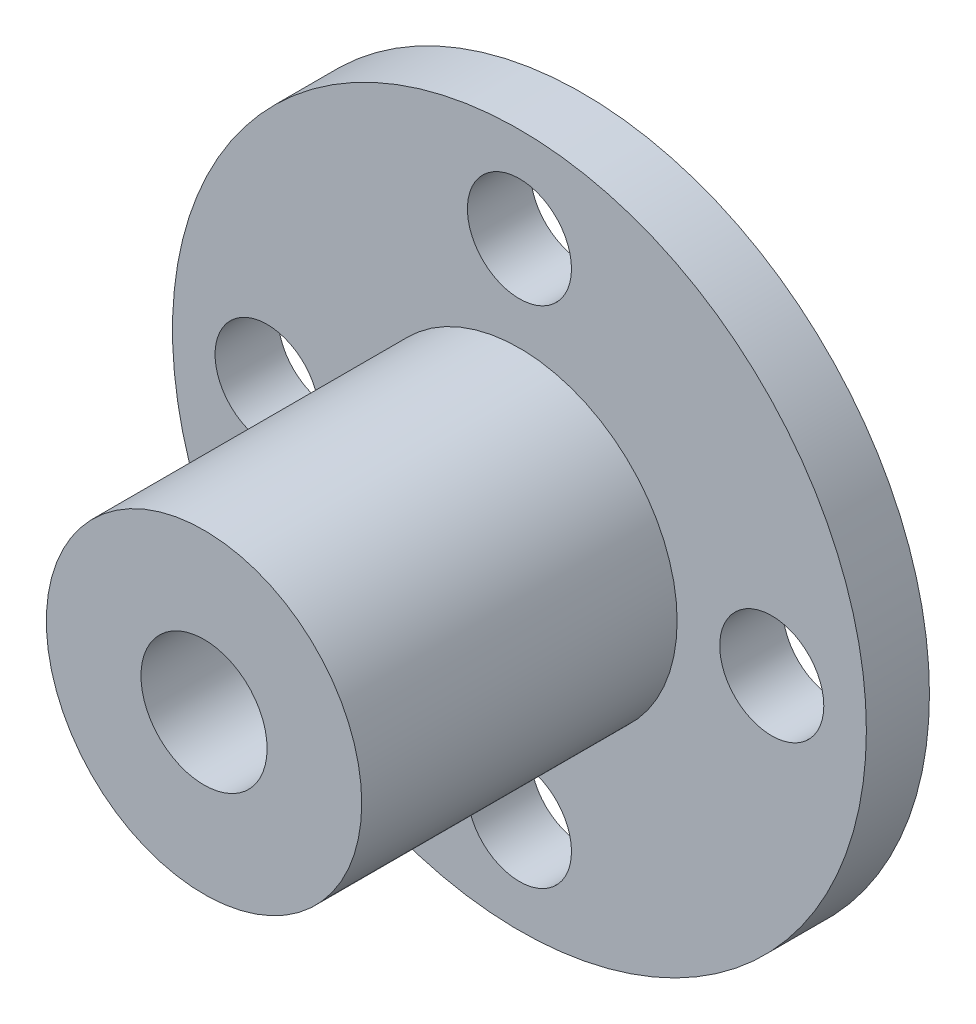
from build123d import *

# Parameters (mm, degrees)
SKETCH_1_R      = 11
SKETCH_1_R_2    = 2
SKETCH_1_R_3    = 1.65
EXTRUDE_1_DEPTH = 2
SKETCH_2_R      = 5
SKETCH_2_R_2    = 2
EXTRUDE_2_DEPTH = 10


with BuildPart() as part:
    # 草图1 → 凸台-拉伸1 (new body)
    with BuildSketch(Plane.XY):
        Circle(SKETCH_1_R)
        Circle(SKETCH_1_R_2, mode=Mode.SUBTRACT)
        with Locations((-8, 0)):
            Circle(SKETCH_1_R_3, mode=Mode.SUBTRACT)
        with Locations((0, 8)):
            Circle(SKETCH_1_R_3, mode=Mode.SUBTRACT)
        with Locations((8, 0)):
            Circle(SKETCH_1_R_3, mode=Mode.SUBTRACT)
        with Locations((0, -8)):
            Circle(SKETCH_1_R_3, mode=Mode.SUBTRACT)
    extrude(amount=EXTRUDE_1_DEPTH)

    # 草图2 → 凸台-拉伸2 (add)
    with BuildSketch(Plane.XY.offset(2)):
        Circle(SKETCH_2_R)
        Circle(SKETCH_2_R_2, mode=Mode.SUBTRACT)
    extrude(amount=EXTRUDE_2_DEPTH)


solid = part.part
